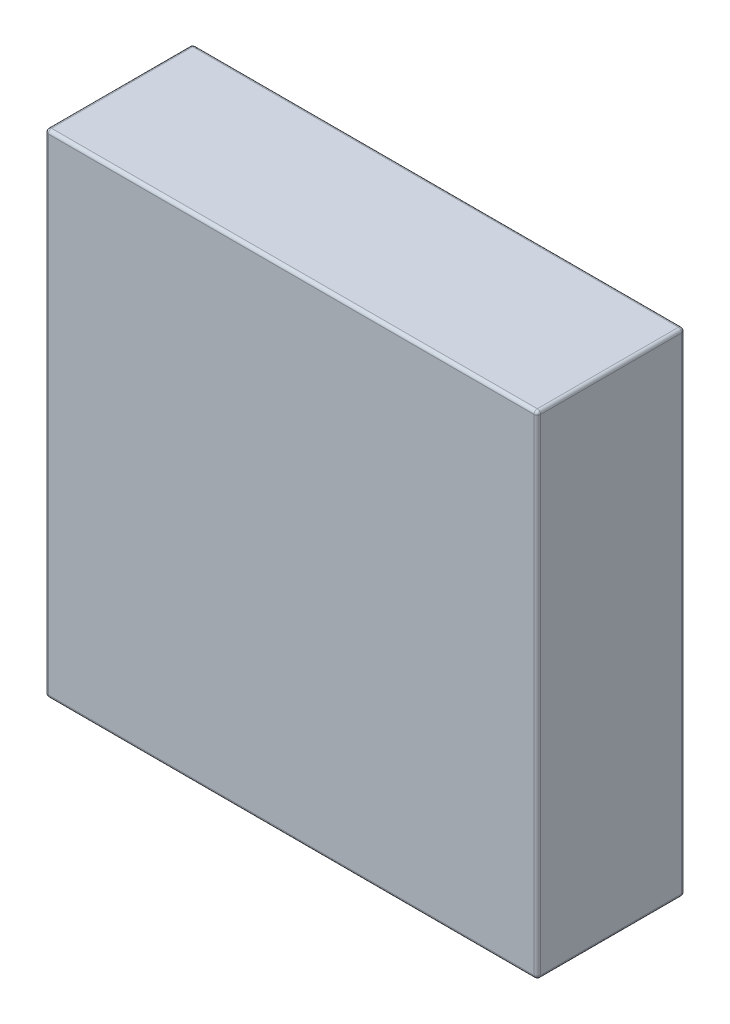
from build123d import *

# Parameters (mm, degrees)
SKETCH1_W           = 150
SKETCH1_H           = 150
BOSS_EXTRUDE1_DEPTH = 45
SKETCH2_W           = 90
SKETCH2_H           = 90
CUT_EXTRUDE1_DEPTH  = 40
SKETCH6_R           = 1.8
CUT_EXTRUDE2_DEPTH  = 20
CIRPATTERN1_COUNT   = 2
CIRPATTERN1_ANGLE   = 90
SKETCH8_R           = 3
CUT_EXTRUDE4_DEPTH  = 17
CIRPATTERN2_COUNT   = 4
FILLET1_R           = 1
FILLET2_R           = 1


with BuildPart() as part:
    # Sketch1 → Boss-Extrude1 (new body)
    with BuildSketch(Plane.XY):
        with Locations((75, 75)):
            Rectangle(SKETCH1_W, SKETCH1_H)
    extrude(amount=BOSS_EXTRUDE1_DEPTH)

    # Sketch2 → Cut-Extrude1 (cut)
    with BuildSketch(Plane.XY):
        with Locations((75, 75)):
            Rectangle(SKETCH2_W, SKETCH2_H)
    extrude(amount=CUT_EXTRUDE1_DEPTH, mode=Mode.SUBTRACT)

    # Sketch6 → Cut-Extrude2 (cut)
    with BuildSketch(Plane(origin=(0, 0, 0), x_dir=(-1, 0, 0), z_dir=(0, 0, -1))):
        with Locations((-135, 75)):
            Circle(SKETCH6_R)
        with Locations((-15, 75)):
            Circle(SKETCH6_R)
    cut_extrude2 = extrude(amount=-CUT_EXTRUDE2_DEPTH, mode=Mode.SUBTRACT)

    # CirPattern1: Cut-Extrude2 ×2 about axis
    cirpattern1_axis = Axis((75, 75, 0), (0, 0, -1))
    for i in range(1, CIRPATTERN1_COUNT):
        add(cut_extrude2.rotate(cirpattern1_axis, i * CIRPATTERN1_ANGLE / (CIRPATTERN1_COUNT - 1)), mode=Mode.SUBTRACT)

    # Sketch8 → Cut-Extrude4 (cut)
    with BuildSketch(Plane(origin=(120, 0, 0), x_dir=(0, 0, -1), z_dir=(1, 0, 0))):
        with Locations(Location((-20, 75, 0), (0, 0, 90))):
            Circle(SKETCH8_R)
    cut_extrude4 = extrude(amount=CUT_EXTRUDE4_DEPTH, mode=Mode.SUBTRACT)

    # CirPattern2: Cut-Extrude4 ×4 about axis
    cirpattern2_axis = Axis((75, 75, 0), (0, 0, 1))
    for i in range(1, CIRPATTERN2_COUNT):
        add(cut_extrude4.rotate(cirpattern2_axis, i * 360 / CIRPATTERN2_COUNT), mode=Mode.SUBTRACT)

    # Fillet1
    fillet1_edges = [part.edges().sort_by_distance(p)[0] for p in [
        (75, 150, 45),
        (0, 75, 45),
        (75, 0, 45),
        (0, 75, 0),
        (75, 150, 0),
        (150, 75, 0),
        (75, 0, 0),
        (0, 0, 22.5),
        (0, 150, 22.5),
        (150, 150, 22.5),
        (150, 0, 22.5),
        (150, 75, 45),
    ]]
    fillet(fillet1_edges, radius=FILLET1_R)

    # Fillet2
    fillet2_edges = [part.edges().sort_by_distance(p)[0] for p in [
        (120, 30, 20),
        (120, 120, 20),
        (30, 120, 20),
        (30, 30, 20),
    ]]
    fillet(fillet2_edges, radius=FILLET2_R)


solid = part.part
